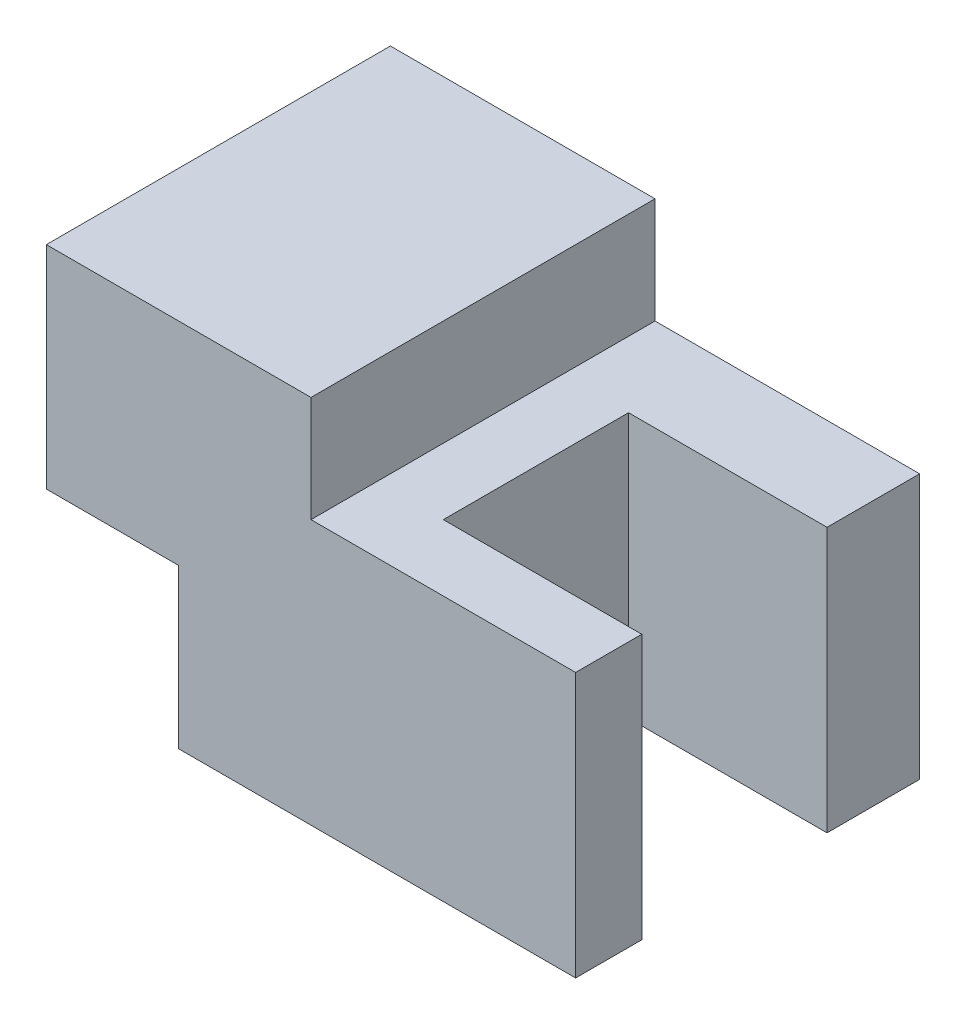
from build123d import *

# Parameters (mm, degrees)
Y_KSEKLIK_EKSTR_ZYON1_DEPTH = 1320.8
IZIM2_W                     = 762
IZIM2_H                     = 711.2
KES_EKSTR_ZYON2_DEPTH       = 1016


with BuildPart() as part:
    # Çizim1 → Yükseklik-Ekstrüzyon1 (new body)
    with BuildSketch(Plane.XY):
        Polygon((-508, 1422.4), (508, 1422.4), (508, 1016), (1524, 1016), (1524, 0), (0, 0), (0, 609.6), (-508, 609.6), align=None)
    extrude(amount=Y_KSEKLIK_EKSTR_ZYON1_DEPTH)

    # Çizim2 → Kes-Ekstrüzyon2 (cut)
    with BuildSketch(Plane(origin=(0, 1016, 0), x_dir=(1, 0, 0), z_dir=(0, 1, 0))):
        with Locations((1143, -711.2)):
            Rectangle(IZIM2_W, IZIM2_H)
    extrude(amount=-KES_EKSTR_ZYON2_DEPTH, mode=Mode.SUBTRACT)


solid = part.part
